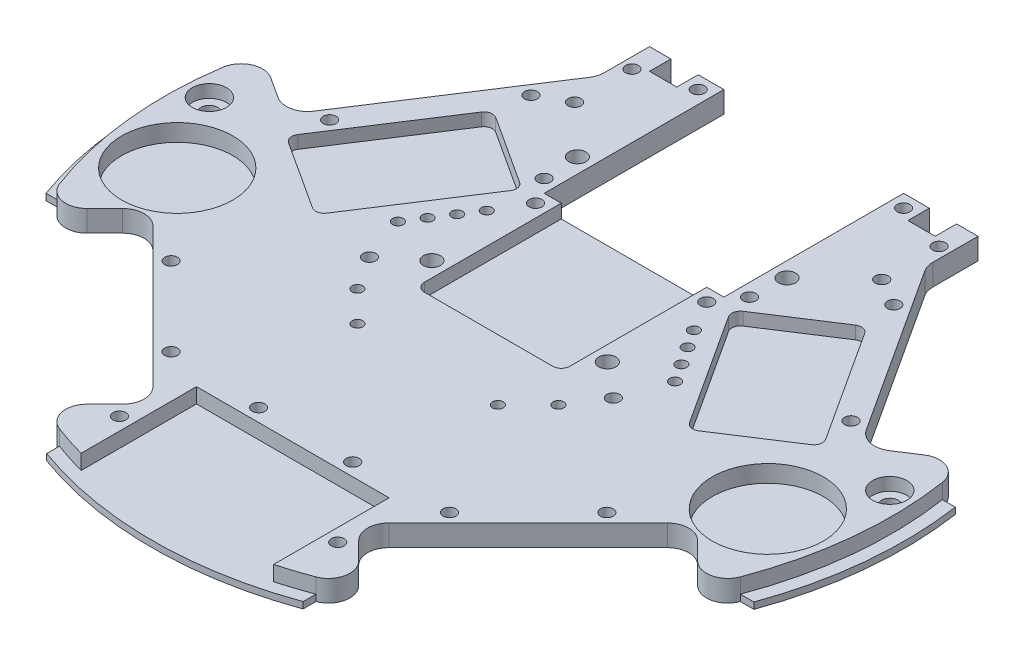
from build123d import *

# Parameters (mm, degrees)
EXTRUDE1_DEPTH  = 5
SKETCH3_W       = 42
SKETCH3_H       = 47
EXTRUDE2_DEPTH  = 5
SKETCH4_W       = 34
SKETCH4_H       = 40
EXTRUDE3_DEPTH  = 3.2
EXTRUDE4_DEPTH  = 3
SKETCH6_R       = 1.5
EXTRUDE5_DEPTH  = 5
SKETCH7_R       = 1.5
EXTRUDE6_DEPTH  = 5
SKETCH8_W       = 6.381599337
SKETCH8_H       = 7
EXTRUDE7_DEPTH  = 5
SKETCH9_R       = 1.5
EXTRUDE8_DEPTH  = 5
FILLET1_R       = 5
FILLET2_R       = 2
SKETCH11_R      = 2
EXTRUDE10_DEPTH = 5
SKETCH15_R      = 13
EXTRUDE13_DEPTH = 4
SKETCH16_W      = 45
SKETCH16_H      = 40
EXTRUDE14_DEPTH = 3.5
SKETCH17_R      = 1.5
EXTRUDE16_DEPTH = 5
SKETCH18_R      = 1.5
EXTRUDE17_DEPTH = 5
SKETCH20_R      = 2
EXTRUDE19_DEPTH = 5
EXTRUDE24_START = -1.5
EXTRUDE24_DEPTH = 1.5
EXTRUDE25_START = -1.5
EXTRUDE25_DEPTH = 1.5
SKETCH27_R      = 1.5
EXTRUDE26_DEPTH = 5
SKETCH28_R      = 1.5
EXTRUDE27_DEPTH = 5
SKETCH29_R      = 4
EXTRUDE28_DEPTH = 3
SKETCH30_R      = 2
EXTRUDE29_DEPTH = 2
SKETCH14_R      = 1.25
EXTRUDE30_DEPTH = 5


with BuildPart() as part:
    # Sketch2 → Extrude1 (new body)
    with BuildSketch(Plane(origin=(0, 0, 0), x_dir=(1, 0, 0), z_dir=(0, 1, 0))):
        with BuildLine():
            Line((82.558104656, 20.227687844), (67.247468193, 10.284844268))
            Line((67.247468193, 10.284844268), (38.381599337, 54.73438437))
            Line((38.381599337, 54.73438437), (38.381599337, 66.73438437))
            Line((38.381599337, 66.73438437), (-38.381599337, 66.73438437))
            Line((-38.381599337, 66.73438437), (-38.381599337, 54.73438437))
            Line((-38.381599337, 54.73438437), (-67.247468193, 10.284844268))
            Line((-67.247468193, 10.284844268), (-82.558104656, 20.227687844))
            ThreePointArc((-82.558104656, 20.227687844), (-84.534361106, -8.884919378), (-76.54843921, -36.950459463))
            Line((-76.54843921, -36.950459463), (-63.639610307, -24.04163056))
            Line((-63.639610307, -24.04163056), (-24.04163056, -63.639610307))
            Line((-24.04163056, -63.639610307), (-36.950459463, -76.54843921))
            ThreePointArc((-36.950459463, -76.54843921), (0, -85), (36.950459463, -76.54843921))
            Line((36.950459463, -76.54843921), (24.04163056, -63.639610307))
            Line((24.04163056, -63.639610307), (63.639610307, -24.04163056))
            Line((63.639610307, -24.04163056), (76.54843921, -36.950459463))
            ThreePointArc((76.54843921, -36.950459463), (84.534361106, -8.884919378), (82.558104656, 20.227687844))
        make_face()
    extrude(amount=-EXTRUDE1_DEPTH)

    # Sketch3 → Extrude2 (cut)
    with BuildSketch(Plane(origin=(0, 0, 0), x_dir=(1, 0, 0), z_dir=(0, 1, 0))):
        with Locations((0, 48.23438437)):
            Rectangle(SKETCH3_W, SKETCH3_H)
    extrude(amount=-EXTRUDE2_DEPTH, mode=Mode.SUBTRACT)

    # Sketch4 → Extrude3 (cut)
    with BuildSketch(Plane(origin=(0, 0, 0), x_dir=(-1, 0, 0), z_dir=(0, 1, 0))):
        with Locations((0, -10.73438437)):
            Rectangle(SKETCH4_W, SKETCH4_H)
    extrude(amount=-EXTRUDE3_DEPTH, mode=Mode.SUBTRACT)

    # Sketch5 → Extrude4 (cut)
    with BuildSketch(Plane(origin=(0, 0, 0), x_dir=(1, 0, 0), z_dir=(0, 1, 0))):
        Polygon((43.470660758, -6.348358315), (62.76008382, 6.17833949), (43.697717595, 35.531809369), (24.408294532, 23.005111563), align=None)
    extrude4 = extrude(amount=-EXTRUDE4_DEPTH, mode=Mode.SUBTRACT)

    # Mirror1: Extrude4 across plane
    add(extrude4.mirror(Plane(origin=(0, 0, 0), x_dir=(0, 0, 1), z_dir=(1, 0, 0))), mode=Mode.SUBTRACT)

    # Sketch6 → Extrude5 (cut)
    with BuildSketch(Plane(origin=(0, 0, 0), x_dir=(1, 0, 0), z_dir=(0, 1, 0))):
        with Locations(Location((42.401256054, 43.036420449, 0), (0, 0, 270))):
            Circle(SKETCH6_R)
        with Locations(Location((60.918983244, 14.521621139, 0), (0, 0, 270))):
            Circle(SKETCH6_R)
        with Locations(Location((50.911688245, -32.526911935, 0), (0, 0, 270))):
            Circle(SKETCH6_R)
        with Locations(Location((32.526911935, -50.911688245, 0), (0, 0, 270))):
            Circle(SKETCH6_R)
    extrude5 = extrude(amount=-EXTRUDE5_DEPTH, mode=Mode.SUBTRACT)

    # Mirror2: Extrude5 across plane
    add(extrude5.mirror(Plane(origin=(0, 0, 0), x_dir=(0, 0, 1), z_dir=(1, 0, 0))), mode=Mode.SUBTRACT)

    # Sketch7 → Extrude6 (cut)
    with BuildSketch(Plane(origin=(0, 0, 0), x_dir=(-1, 0, 0), z_dir=(0, 1, 0))):
        with Locations(Location((-24, -63.73438437, 0), (0, 0, 90))):
            Circle(SKETCH7_R)
        with Locations(Location((-24, -27.73438437, 0), (0, 0, 90))):
            Circle(SKETCH7_R)
    extrude6 = extrude(amount=-EXTRUDE6_DEPTH, mode=Mode.SUBTRACT)

    # Mirror3: Extrude6 across plane
    add(extrude6.mirror(Plane(origin=(0, 0, 0), x_dir=(0, 0, 1), z_dir=(1, 0, 0))), mode=Mode.SUBTRACT)

    # Sketch8 → Extrude7 (cut)
    with BuildSketch(Plane(origin=(0, 0, 0), x_dir=(1, 0, 0), z_dir=(0, 1, 0))):
        with Locations((30.190799669, 65.23438437)):
            Rectangle(SKETCH8_W, SKETCH8_H)
    extrude7 = extrude(amount=-EXTRUDE7_DEPTH, mode=Mode.SUBTRACT)

    # Mirror4: Extrude7 across plane
    add(extrude7.mirror(Plane(origin=(0, 0, 0), x_dir=(0, 0, 1), z_dir=(1, 0, 0))), mode=Mode.SUBTRACT)

    # Sketch9 → Extrude8 (cut)
    with BuildSketch(Plane(origin=(0, 0, 0), x_dir=(1, 0, 0), z_dir=(0, 1, 0))):
        with Locations(Location((35.881599337, 60.13438437, 0), (0, 0, 270))):
            Circle(SKETCH9_R)
        with Locations(Location((35.881599337, 46.73438437, 0), (0, 0, 270))):
            Circle(SKETCH9_R)
    extrude8 = extrude(amount=-EXTRUDE8_DEPTH, mode=Mode.SUBTRACT)

    # Mirror5: Extrude8 across plane
    add(extrude8.mirror(Plane(origin=(0, 0, 0), x_dir=(0, 0, 1), z_dir=(1, 0, 0))), mode=Mode.SUBTRACT)

    # Fillet1
    fillet1_edges = [part.edges().sort_by_distance(p)[0] for p in [
        (76.54843921, -2.5, 36.950459463),
        (63.639610307, -2.5, 24.04163056),
        (24.04163056, -2.5, 63.639610307),
        (36.950459463, -2.5, 76.54843921),
        (-36.950459463, -2.5, 76.54843921),
        (-24.04163056, -2.5, 63.639610307),
        (-63.639610307, -2.5, 24.04163056),
        (-76.54843921, -2.5, 36.950459463),
        (-82.558104656, -2.5, -20.227687844),
        (-67.247468193, -2.5, -10.284844268),
        (-38.381599337, -2.5, -54.73438437),
        (38.381599337, -2.5, -54.73438437),
        (67.247468193, -2.5, -10.284844268),
        (82.558104656, -2.5, -20.227687844),
    ]]
    fillet(fillet1_edges, radius=FILLET1_R)

    # Fillet2
    fillet2_edges = [part.edges().sort_by_distance(p)[0] for p in [
        (-43.470660758, -1.5, 6.348358315),
        (-62.76008382, -1.5, -6.17833949),
        (-43.697717595, -1.5, -35.531809369),
        (-17, -1.6, 9.26561563),
        (17, -1.6, 9.26561563),
        (43.470660758, -1.5, 6.348358315),
        (24.408294532, -1.5, -23.005111563),
        (43.697717595, -1.5, -35.531809369),
        (62.76008382, -1.5, -6.17833949),
        (-24.408294532, -1.5, -23.005111563),
    ]]
    fillet(fillet2_edges, radius=FILLET2_R)

    # Sketch11 → Extrude10 (cut)
    with BuildSketch(Plane(origin=(0, 0, 0), x_dir=(1, 0, 0), z_dir=(0, 1, 0))):
        with Locations(Location((24.5, 36, 0), (0, 0, 270))):
            Circle(SKETCH11_R)
        with Locations(Location((-24.5, 36, 0), (0, 0, 270))):
            Circle(SKETCH11_R)
    extrude(amount=-EXTRUDE10_DEPTH, mode=Mode.SUBTRACT)

    # Sketch15 → Extrude13 (cut)
    with BuildSketch(Plane(origin=(0, 0, 0), x_dir=(1, 0, 0), z_dir=(0, 1, 0))):
        with Locations(Location((69, -13, 0), (0, 0, 270))):
            Circle(SKETCH15_R)
    extrude13 = extrude(amount=-EXTRUDE13_DEPTH, mode=Mode.SUBTRACT)

    # Mirror7: Extrude13 across plane
    add(extrude13.mirror(Plane(origin=(0, 0, 0), x_dir=(0, 0, 1), z_dir=(1, 0, 0))), mode=Mode.SUBTRACT)

    # Sketch16 → Extrude14 (cut)
    with BuildSketch(Plane(origin=(0, 0, 0), x_dir=(1, 0, 0), z_dir=(0, 1, 0))):
        with Locations((0, -75)):
            Rectangle(SKETCH16_W, SKETCH16_H)
    extrude(amount=-EXTRUDE14_DEPTH, mode=Mode.SUBTRACT)

    # Sketch17 → Extrude16 (cut)
    with BuildSketch(Plane(origin=(0, 0, 0), x_dir=(1, 0, 0), z_dir=(0, 1, 0))):
        with Locations(Location((25.5, -70, 0), (0, 0, 270))):
            Circle(SKETCH17_R)
        with Locations(Location((-25.5, -70, 0), (0, 0, 270))):
            Circle(SKETCH17_R)
    extrude(amount=-EXTRUDE16_DEPTH, mode=Mode.SUBTRACT)

    # Sketch18 → Extrude17 (cut)
    with BuildSketch(Plane(origin=(0, 0, 0), x_dir=(-1, 0, 0), z_dir=(0, 1, 0))):
        with Locations(Location((-11, 52, 0), (0, 0, 90))):
            Circle(SKETCH18_R)
        with Locations(Location((11, 52, 0), (0, 0, 90))):
            Circle(SKETCH18_R)
    extrude(amount=-EXTRUDE17_DEPTH, mode=Mode.SUBTRACT)

    # Sketch20 → Extrude19 (cut)
    with BuildSketch(Plane(origin=(0, 0, 0), x_dir=(1, 0, 0), z_dir=(0, 1, 0))):
        with Locations(Location((20.5, -2, 0), (0, 0, 270))):
            Circle(SKETCH20_R)
        with Locations(Location((-20.5, -2, 0), (0, 0, 270))):
            Circle(SKETCH20_R)
    extrude(amount=-EXTRUDE19_DEPTH, mode=Mode.SUBTRACT)

    # Sketch23 → Extrude24 (add)
    with BuildSketch(Plane.XZ.offset(5).offset(EXTRUDE24_START)):
        with BuildLine():
            Line((84.035839065, -12.766274034), (87.035839065, -12.766274034))
            ThreePointArc((87.035839065, -12.766274034), (87.519327499, 8.864668549), (82.708242384, 29.959333706))
            Line((82.708242384, 29.959333706), (79.545196737, 29.959333706))
            ThreePointArc((79.545196737, 29.959333706), (84.534361106, 8.884919378), (84.035839065, -12.766274034))
        make_face()
    extrude24 = extrude(amount=EXTRUDE24_DEPTH)

    # Mirror8: Extrude24 across plane
    add(extrude24.mirror(Plane(origin=(0, 0, 0), x_dir=(0, 0, 1), z_dir=(1, 0, 0))))

    # Sketch24 → Extrude25 (add)
    with BuildSketch(Plane.XZ.offset(5).offset(EXTRUDE25_START)):
        with BuildLine():
            Line((-29.959333706, 79.545196737), (-29.959333706, 82.545196737))
            ThreePointArc((-29.959333706, 82.545196737), (0, 87.8138439), (29.959333706, 82.545196737))
            Line((29.959333706, 82.545196737), (29.959333706, 79.545196737))
            ThreePointArc((29.959333706, 79.545196737), (0, 85), (-29.959333706, 79.545196737))
        make_face()
    extrude(amount=EXTRUDE25_DEPTH)

    # Sketch27 → Extrude26 (cut)
    with BuildSketch(Plane(origin=(0, 0, 0), x_dir=(1, 0, 0), z_dir=(0, 1, 0))):
        with Locations(Location((20, 21.73438437, 0), (0, 0, 270))):
            Circle(SKETCH27_R)
        with Locations(Location((-20, 21.73438437, 0), (0, 0, 270))):
            Circle(SKETCH27_R)
    extrude(amount=-EXTRUDE26_DEPTH, mode=Mode.SUBTRACT)

    # Sketch28 → Extrude27 (cut)
    with BuildSketch(Plane(origin=(0, 0, 0), x_dir=(1, 0, 0), z_dir=(0, 1, 0))):
        with Locations(Location((28.5, -8.6, 0), (0, 0, 270))):
            Circle(SKETCH28_R)
        with Locations(Location((-28.5, -8.6, 0), (0, 0, 270))):
            Circle(SKETCH28_R)
    extrude(amount=-EXTRUDE27_DEPTH, mode=Mode.SUBTRACT)

    # Sketch29 → Extrude28 (cut)
    with BuildSketch(Plane(origin=(0, 0, 0), x_dir=(1, 0, 0), z_dir=(0, 1, 0))):
        with Locations(Location((-79.5, 5, 0), (0, 0, 270))):
            Circle(SKETCH29_R)
        with Locations(Location((79.5, 5, 0), (0, 0, 270))):
            Circle(SKETCH29_R)
    extrude(amount=-EXTRUDE28_DEPTH, mode=Mode.SUBTRACT)

    # Sketch30 → Extrude29 (cut)
    with BuildSketch(Plane(origin=(0, -3, 0), x_dir=(1, 0, 0), z_dir=(0, 1, 0))):
        with Locations(Location((79.5, 5, 0), (0, 0, 270))):
            Circle(SKETCH30_R)
        with Locations(Location((-79.5, 5, 0), (0, 0, 270))):
            Circle(SKETCH30_R)
    extrude(amount=-EXTRUDE29_DEPTH, mode=Mode.SUBTRACT)

    # Sketch14 → Extrude30 (cut)
    with BuildSketch(Plane(origin=(0, 0, 0), x_dir=(1, 0, 0), z_dir=(0, 1, 0))):
        with Locations(Location((24.203535757, 14.52559661, 0), (0, 0, 270))):
            Circle(SKETCH14_R)
        with Locations(Location((29.649926107, 6.13889093, 0), (0, 0, 270))):
            Circle(SKETCH14_R)
        with Locations(Location((23.483016203, -16.411948391, 0), (0, 0, 270))):
            Circle(SKETCH14_R)
        with Locations(Location((16.411948391, -23.483016203, 0), (0, 0, 270))):
            Circle(SKETCH14_R)
        with Locations(Location((26.926730932, 10.33224377, 0), (0, 0, 270))):
            Circle(SKETCH14_R)
        with Locations(Location((32.373121282, 1.945538091, 0), (0, 0, 270))):
            Circle(SKETCH14_R)
    extrude30 = extrude(amount=-EXTRUDE30_DEPTH, mode=Mode.SUBTRACT)

    # Mirror9: Extrude30 across plane
    add(extrude30.mirror(Plane(origin=(0, 0, 0), x_dir=(0, 0, 1), z_dir=(1, 0, 0))), mode=Mode.SUBTRACT)


solid = part.part
